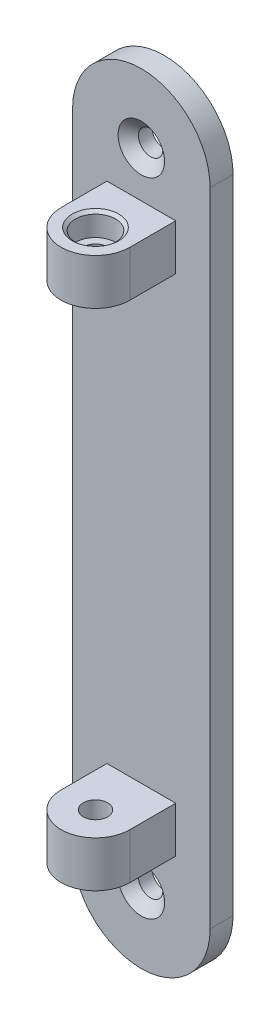
from build123d import *

# Parameters (mm, degrees)
BOSS_EXTRUDE1_DEPTH                                 = 6.35
CSK_FOR_1_4_FLAT_HEAD_MACHINE_SCREW_100_D           = 6.7564
CSK_FOR_1_4_FLAT_HEAD_MACHINE_SCREW_100_CSINK_D     = 12.8778
CSK_FOR_1_4_FLAT_HEAD_MACHINE_SCREW_100_CSINK_ANGLE = 100
SKETCH4_W                                           = 19.05
SKETCH4_H                                           = 12.7
BOSS_EXTRUDE2_DEPTH                                 = 12.7
BOSS_EXTRUDE4_DEPTH                                 = 12.7


with BuildPart() as part:
    # Sketch1 → Boss-Extrude1 (new body)
    with BuildSketch(Plane.XY):
        with BuildLine():
            Line((0, 0), (38.1, 0))
            Line((38.1, 0), (38.1, 88.9))
            ThreePointArc((38.1, 88.9), (19.05, 107.95), (0, 88.9))
            Line((0, 88.9), (0, 0))
        make_face()
    boss_extrude1 = extrude(amount=BOSS_EXTRUDE1_DEPTH)

    # CSK for 1/4 Flat Head Machine Screw (100)1 (through all)
    with Locations(Plane.XY.offset(6.35)):
        with Locations((19.05, 88.9)):
            csk_for_1_4_flat_head_machine_screw_100 = CounterSinkHole(CSK_FOR_1_4_FLAT_HEAD_MACHINE_SCREW_100_D / 2, CSK_FOR_1_4_FLAT_HEAD_MACHINE_SCREW_100_CSINK_D / 2, counter_sink_angle=CSK_FOR_1_4_FLAT_HEAD_MACHINE_SCREW_100_CSINK_ANGLE)

    # Sketch4 → Boss-Extrude2 (add)
    with BuildSketch(Plane.XY.offset(6.35)):
        with Locations((19.05, 69.85)):
            Rectangle(SKETCH4_W, SKETCH4_H)
    boss_extrude2 = extrude(amount=BOSS_EXTRUDE2_DEPTH)

    # Sketch12 → Boss-Extrude4 (add)
    with BuildSketch(Plane(origin=(0, 76.2, 0), x_dir=(1, 0, 0), z_dir=(0, 1, 0))):
        with BuildLine():
            Line((9.525, -19.05), (28.575, -19.05))
            ThreePointArc((28.575, -19.05), (19.05, -28.575), (9.525, -19.05))
        make_face()
    boss_extrude4 = extrude(amount=-BOSS_EXTRUDE4_DEPTH)

    # Sketch14 → CBORE for 1/4 Socket Head Cap Screw1 (revolve, cut)
    with BuildSketch(Plane(origin=(19.05, 76.2, 19.05), x_dir=(0, 0, 1), z_dir=(1, 0, 0))):
        Polygon((0, 0), (0, 141.728827343), (3.3782, 139.699), (3.3782, 6.35), (5.55625, 6.35), (5.55625, 0.740631289), (6.4389, 0), align=None)
    cbore_for_1_4_socket_head_cap_screw1 = revolve(axis=Axis((19.05, 82.55, 19.05), (0, -1, 0)), mode=Mode.SUBTRACT)

    # Mirror3: Boss-Extrude1, CSK for 1/4 Flat Head Machine Screw (100)1, Boss-Extrude2, Boss-Extrude4, CBORE for 1/4 Socket Head Cap Screw1 across plane
    add(boss_extrude1.mirror(Plane(origin=(0, 0, 6.35), x_dir=(0, 0, 1), z_dir=(0, 1, 0))))
    add(csk_for_1_4_flat_head_machine_screw_100.mirror(Plane(origin=(0, 0, 6.35), x_dir=(0, 0, 1), z_dir=(0, 1, 0))), mode=Mode.SUBTRACT)
    add(boss_extrude2.mirror(Plane(origin=(0, 0, 6.35), x_dir=(0, 0, 1), z_dir=(0, 1, 0))))
    add(boss_extrude4.mirror(Plane(origin=(0, 0, 6.35), x_dir=(0, 0, 1), z_dir=(0, 1, 0))))
    add(cbore_for_1_4_socket_head_cap_screw1.mirror(Plane(origin=(0, 0, 6.35), x_dir=(0, 0, 1), z_dir=(0, 1, 0))), mode=Mode.SUBTRACT)


solid = part.part
